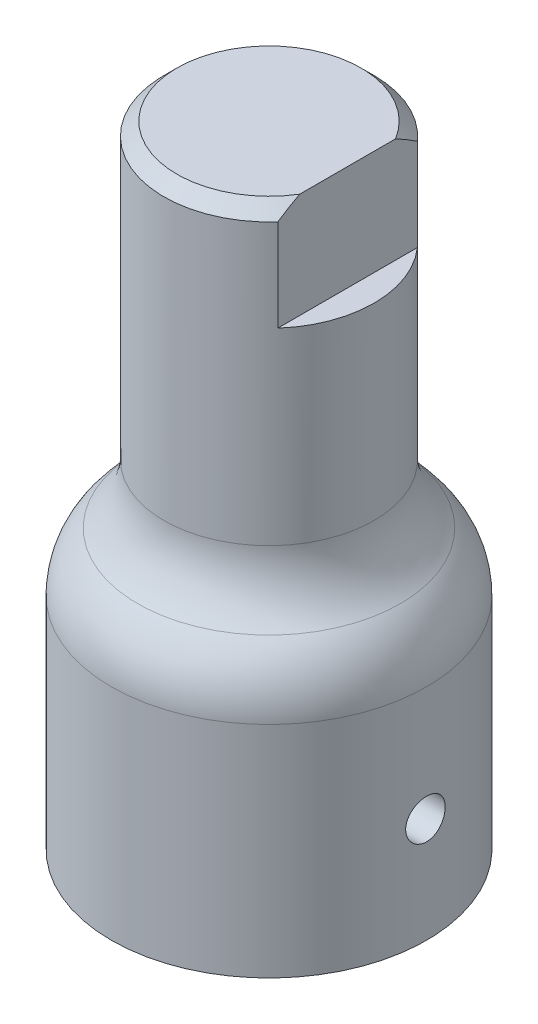
from build123d import *

# Parameters (mm, degrees)
CUT_EXTRUDE_1_DEPTH    = 6.35
CUT_EXTRUDE_START      = -12.7
CUT_EXTRUDE_2_DEPTH    = 12.7
HOLE_WIZARD_M2_1_D     = 2.3876
HOLE_WIZARD_M2_1_DEPTH = 4.7752
CHAMFER_1_SIZE         = 0.7874


with BuildPart() as part:
    # 스케치1 → 회전1 (revolve)
    with BuildSketch(Plane.XY, mode=Mode.PRIVATE) as revolve_1_sk:
        with BuildLine():
            Line((6.35, 38.1), (0, 38.1))
            Line((0, 38.1), (0, 0))
            Line((0, 0), (9.525, 0))
            Line((9.525, 0), (9.525, 13.263233373))
            ThreePointArc((9.525, 13.263233373), (9.110100453, 15.210106507), (7.9375, 16.818666364))
            ThreePointArc((7.9375, 16.818666364), (6.764899547, 18.42722622), (6.35, 20.374099354))
            Line((6.35, 20.374099354), (6.35, 38.1))
        make_face()
    revolve(revolve_1_sk.sketch.rotate(Axis((0, 38.1, 0), (0, -1, 0)), 270), axis=Axis((0, 38.1, 0), (0, -1, 0)))

    # 스케치2 → 컷-돌출1 (cut)
    with BuildSketch(Plane(origin=(0, 38.1, 0), x_dir=(-1, 0, 0), z_dir=(0, 1, 0))):
        with BuildLine():
            Line((-4.7498, -4.214486915), (-4.7498, 4.214486915))
            ThreePointArc((-4.7498, 4.214486915), (-6.35, 0), (-4.7498, -4.214486915))
        make_face()
    extrude(amount=-CUT_EXTRUDE_1_DEPTH, mode=Mode.SUBTRACT)

    # 스케치3 → 컷-돌출2 (cut)
    with BuildSketch(Plane.XZ.offset(CUT_EXTRUDE_START)):
        with BuildLine():
            Line((4.7498, -4.214486915), (4.7498, 4.214486915))
            ThreePointArc((4.7498, 4.214486915), (-6.35, 0), (4.7498, -4.214486915))
        make_face()
    extrude(amount=CUT_EXTRUDE_2_DEPTH, mode=Mode.SUBTRACT)

    # M2 여유 구멍1
    with Locations(Plane.ZY.offset(-4.7498)):
        with Locations((0, 6.35)):
            Hole(HOLE_WIZARD_M2_1_D / 2, depth=HOLE_WIZARD_M2_1_DEPTH)

    # 모따기1
    chamfer_1_edges = [part.edges().sort_by_distance(p)[0] for p in [
        (-5.791566796, 38.1, 2.603892095),
    ]]
    chamfer(chamfer_1_edges, length=CHAMFER_1_SIZE)


solid = part.part
